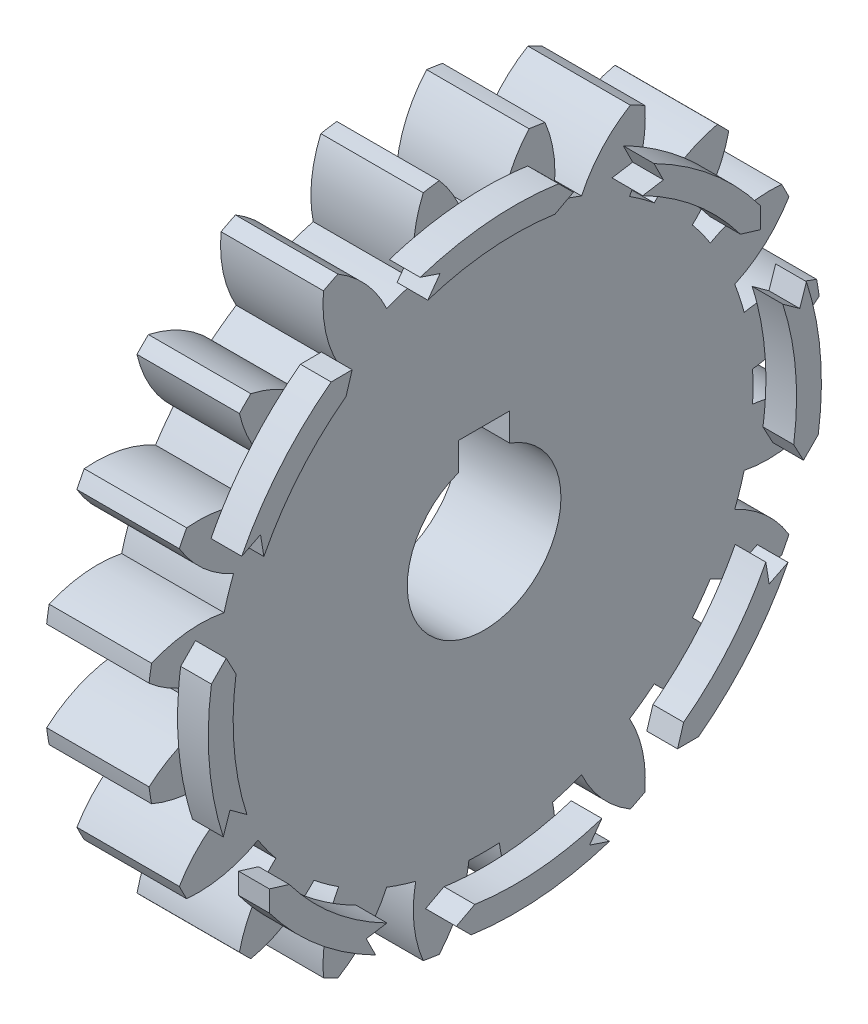
from build123d import *

# Parameters (mm, degrees)
BASPROSKE_W         = 10
BASPROSKE_H         = 33
TOOTHCUT_DEPTH      = 48.728398255
TEETHCUTS_COUNT     = 20
TEETHCUTS_ANGLE     = 342
BORSKE_R            = 7.5
BORE_DEPTH          = 50.0007112
KEYSKE_W            = 5
KEYSKE_H            = 9.8
KEYWAY_DEPTH        = 50.0007112
BOSS_EXTRUDE1_DEPTH = 3
CIRPATTERN1_COUNT   = 8


with BuildPart() as part:
    # BasProSke → Base-Revolve (revolve)
    with BuildSketch(Plane(origin=(0, 0, 0), x_dir=(1, 0, 0), z_dir=(0, 1, 0)), mode=Mode.PRIVATE) as base_revolve_sk:
        with Locations((5, 16.5)):
            Rectangle(BASPROSKE_W, BASPROSKE_H)
    revolve(base_revolve_sk.sketch.rotate(Axis((-10, 0, 0), (1, 0, 0)), 180), axis=Axis((-10, 0, 0), (1, 0, 0)))

    # TooCutSke → ToothCut (cut, through all)
    with BuildSketch(Plane(origin=(0, 0, 0), x_dir=(0, 0, -1), z_dir=(1, 0, 0))):
        with BuildLine():
            ThreePointArc((1.489278925, 26.206717637), (0, 26.249), (-1.489278925, 26.206717637))
            ThreePointArc((-1.489278925, 26.206717637), (-2.448651415, 29.690511169), (-4.401620335, 32.730762038))
            ThreePointArc((-4.401620335, 32.730762038), (0, 33.0254), (4.401620335, 32.730762038))
            ThreePointArc((4.401620335, 32.730762038), (2.448651415, 29.690511169), (1.489278925, 26.206717637))
        make_face()
    toothcut = extrude(amount=TOOTHCUT_DEPTH, mode=Mode.SUBTRACT)

    # TeethCuts: ToothCut ×20 about axis
    teethcuts_axis = Axis((-10, 0, 0), (1, 0, 0))
    for i in range(1, TEETHCUTS_COUNT):
        add(toothcut.rotate(teethcuts_axis, i * TEETHCUTS_ANGLE / (TEETHCUTS_COUNT - 1)), mode=Mode.SUBTRACT)

    # BorSke → Bore (cut, symmetric)
    with BuildSketch(Plane(origin=(0, 0, 0), x_dir=(0, 0, -1), z_dir=(1, 0, 0))):
        with Locations(Location((0, 0, 0), (0, 0, 180))):
            Circle(BORSKE_R)
    extrude(amount=BORE_DEPTH, both=True, mode=Mode.SUBTRACT)

    # KeySke → Keyway (cut, symmetric)
    with BuildSketch(Plane(origin=(0, 0, 0), x_dir=(0, 0, -1), z_dir=(1, 0, 0))):
        with Locations((0, 4.9)):
            Rectangle(KEYSKE_W, KEYSKE_H)
    extrude(amount=KEYWAY_DEPTH, both=True, mode=Mode.SUBTRACT)

    # Sketch1 → Boss-Extrude1 (add)
    with BuildSketch(Plane(origin=(10, 0, 0), x_dir=(0, 0, -1), z_dir=(1, 0, 0))):
        with BuildLine():
            Line((-25.839643669, 15.093655622), (-24.825054486, 14.501005819))
            ThreePointArc((-24.825054486, 14.501005819), (-21.453139957, 19.139626067), (-17.227665112, 23.016734234))
            Line((-17.227665112, 23.016734234), (-17.931752295, 23.957418154))
            ThreePointArc((-17.931752295, 23.957418154), (-22.329920459, 19.921854263), (-25.839643669, 15.093655622))
        make_face()
        with BuildLine():
            Line((-26.661823455, 13.588701007), (-24.825054486, 14.501005819))
            Line((-24.825054486, 14.501005819), (-25.839643669, 15.093655622))
            ThreePointArc((-25.839643669, 15.093655622), (-26.261516229, 14.347069051), (-26.661823455, 13.588701007))
        make_face()
        with BuildLine():
            Line((-24.825054486, 14.501005819), (-24.501257979, 12.487528077))
            ThreePointArc((-24.501257979, 12.487528077), (-24.133390018, 13.184441066), (-23.745704291, 13.870527305))
            Line((-23.745704291, 13.870527305), (-24.825054486, 14.501005819))
        make_face()
        with BuildLine():
            Line((-24.825054486, 14.501005819), (-23.745704291, 13.870527305))
            ThreePointArc((-23.745704291, 13.870527305), (-20.520394741, 18.307468412), (-16.478636194, 22.016006658))
            Line((-16.478636194, 22.016006658), (-17.227665112, 23.016734234))
            ThreePointArc((-17.227665112, 23.016734234), (-21.453139957, 19.139626067), (-24.825054486, 14.501005819))
        make_face()
        with BuildLine():
            Line((-17.931752295, 23.957418154), (-17.227665112, 23.016734234))
            ThreePointArc((-17.227665112, 23.016734234), (-16.56108782, 23.500912115), (-15.880910955, 23.965791605))
            Line((-15.880910955, 23.965791605), (-17.931752295, 23.957418154))
        make_face()
        with BuildLine():
            Line((-17.227665112, 23.016734234), (-16.478636194, 22.016006658))
            Line((-16.478636194, 22.016006658), (-15.880910955, 23.965791605))
            ThreePointArc((-15.880910955, 23.965791605), (-16.56108782, 23.500912115), (-17.227665112, 23.016734234))
        make_face()
    boss_extrude1 = extrude(amount=BOSS_EXTRUDE1_DEPTH)

    # CirPattern1: Boss-Extrude1 ×8 about axis
    cirpattern1_axis = Axis((0, 0, 0), (1, 0, 0))
    for i in range(1, CIRPATTERN1_COUNT):
        add(boss_extrude1.rotate(cirpattern1_axis, i * 360 / CIRPATTERN1_COUNT))


solid = part.part
